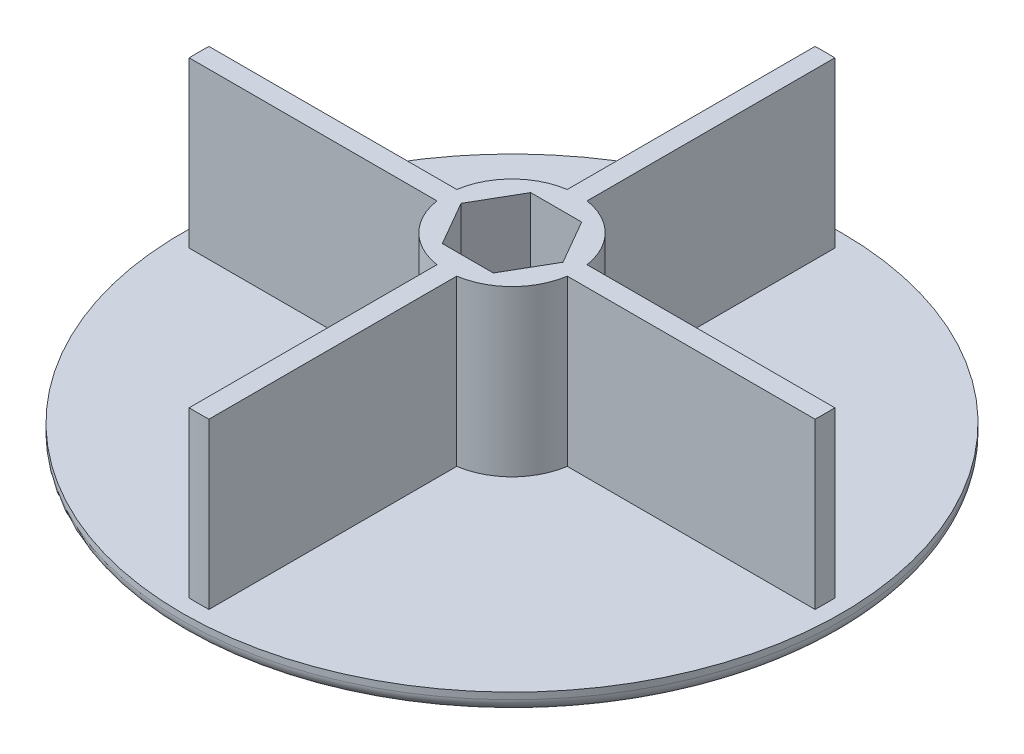
from build123d import *

# Parameters (mm, degrees)
ESQUISSE1_R             = 50
ESQUISSE1_R_2           = 4.25
BOSS_EXTRU_1_DEPTH      = 3
ESQUISSE2_R             = 4.25
BOSS_EXTRU_2_DEPTH      = 25
ENL_V_MAT_EXTRU_1_DEPTH = 20
CONG_1_R                = 2


with BuildPart() as part:
    # Esquisse1 → Boss.-Extru.1 (new body)
    with BuildSketch(Plane(origin=(0, 0, 0), x_dir=(1, 0, 0), z_dir=(0, 1, 0))):
        with Locations(Location((0, 0, 0), (0, 0, 270))):
            Circle(ESQUISSE1_R)
        with Locations(Location((0, 0, 0), (0, 0, 270))):
            Circle(ESQUISSE1_R_2, mode=Mode.SUBTRACT)
    extrude(amount=BOSS_EXTRU_1_DEPTH)

    # Esquisse2 → Boss.-Extru.2 (add)
    with BuildSketch(Plane(origin=(0, 3, 0), x_dir=(1, 0, 0), z_dir=(0, 1, 0))):
        with BuildLine():
            Line((9.886859967, 1.5), (47.476309882, 1.5))
            ThreePointArc((47.476309882, 1.5), (47.5, 0), (47.476309882, -1.5))
            Line((47.476309882, -1.5), (9.886859967, -1.5))
            ThreePointArc((9.886859967, -1.5), (7.071067812, -7.071067812), (1.5, -9.886859967))
            Line((1.5, -9.886859967), (1.5, -47.476309882))
            ThreePointArc((1.5, -47.476309882), (0, -47.5), (-1.5, -47.476309882))
            Line((-1.5, -47.476309882), (-1.5, -9.886859967))
            ThreePointArc((-1.5, -9.886859967), (-7.071067812, -7.071067812), (-9.886859967, -1.5))
            Line((-9.886859967, -1.5), (-47.476309882, -1.5))
            ThreePointArc((-47.476309882, -1.5), (-47.5, 0), (-47.476309882, 1.5))
            Line((-47.476309882, 1.5), (-9.886859967, 1.5))
            ThreePointArc((-9.886859967, 1.5), (-7.071067812, 7.071067812), (-1.5, 9.886859967))
            Line((-1.5, 9.886859967), (-1.5, 47.476309882))
            ThreePointArc((-1.5, 47.476309882), (0, 47.5), (1.5, 47.476309882))
            Line((1.5, 47.476309882), (1.5, 9.886859967))
            ThreePointArc((1.5, 9.886859967), (7.071067812, 7.071067812), (9.886859967, 1.5))
        make_face()
        with Locations(Location((0, 0, 0), (0, 0, 270))):
            Circle(ESQUISSE2_R, mode=Mode.SUBTRACT)
    extrude(amount=BOSS_EXTRU_2_DEPTH)

    # Esquisse3 → Enlèv. mat.-Extru.1 (cut)
    with BuildSketch(Plane(origin=(0, 28, 0), x_dir=(1, 0, 0), z_dir=(0, 1, 0))):
        Polygon((7.736493607, 0), (3.868246804, 6.7), (-3.868246804, 6.7), (-7.736493607, 0), (-3.868246804, -6.7), (3.868246804, -6.7), align=None)
    extrude(amount=-ENL_V_MAT_EXTRU_1_DEPTH, mode=Mode.SUBTRACT)

    # Congé1
    cong_1_edges = [part.edges().sort_by_distance(p)[0] for p in [
        (0, 0, -50),
        (0, 0, -4.25),
    ]]
    fillet(cong_1_edges, radius=CONG_1_R)


solid = part.part
